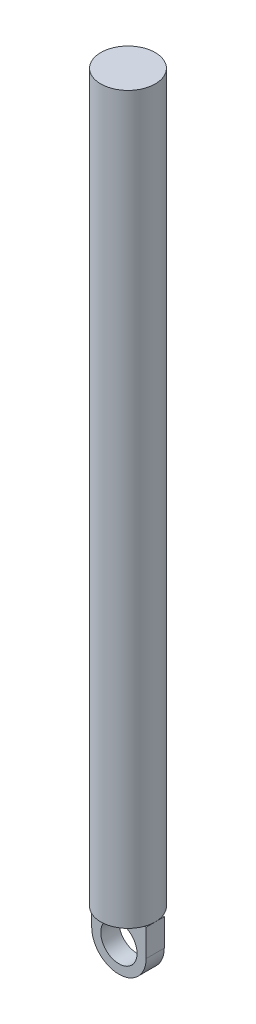
from build123d import *

# Parameters (mm, degrees)
SKETCH_1_W           = 0.75
SKETCH_1_H           = 20
EXTRUDE_2_DEPTH      = 0.25
EXTRUDE_2_DEPTH_BACK = 0.25
SKETCH_3_R           = 0.5


with BuildPart() as part:
    # 草圖1 → 旋轉4 (revolve)
    with BuildSketch(Plane.XY):
        with Locations((1.875, 10)):
            Rectangle(SKETCH_1_W, SKETCH_1_H)
    revolve(axis=Axis((1.5, 20, 0), (0, -1, 0)))

    # 草圖3 → 填料-伸長2 (add, two sides: drawn at the far end of the back side and taken through both)
    with BuildSketch(Plane.XY.offset(-EXTRUDE_2_DEPTH_BACK)):
        with BuildLine():
            Line((2.25, 0), (0.75, 0))
            Line((0.75, 0), (0.75, -0.75))
            ThreePointArc((0.75, -0.75), (1.5, -1.5), (2.25, -0.75))
            Line((2.25, -0.75), (2.25, 0))
        make_face()
        with Locations((1.5, -0.75)):
            Circle(SKETCH_3_R, mode=Mode.SUBTRACT)
    extrude(amount=EXTRUDE_2_DEPTH + EXTRUDE_2_DEPTH_BACK)


solid = part.part
